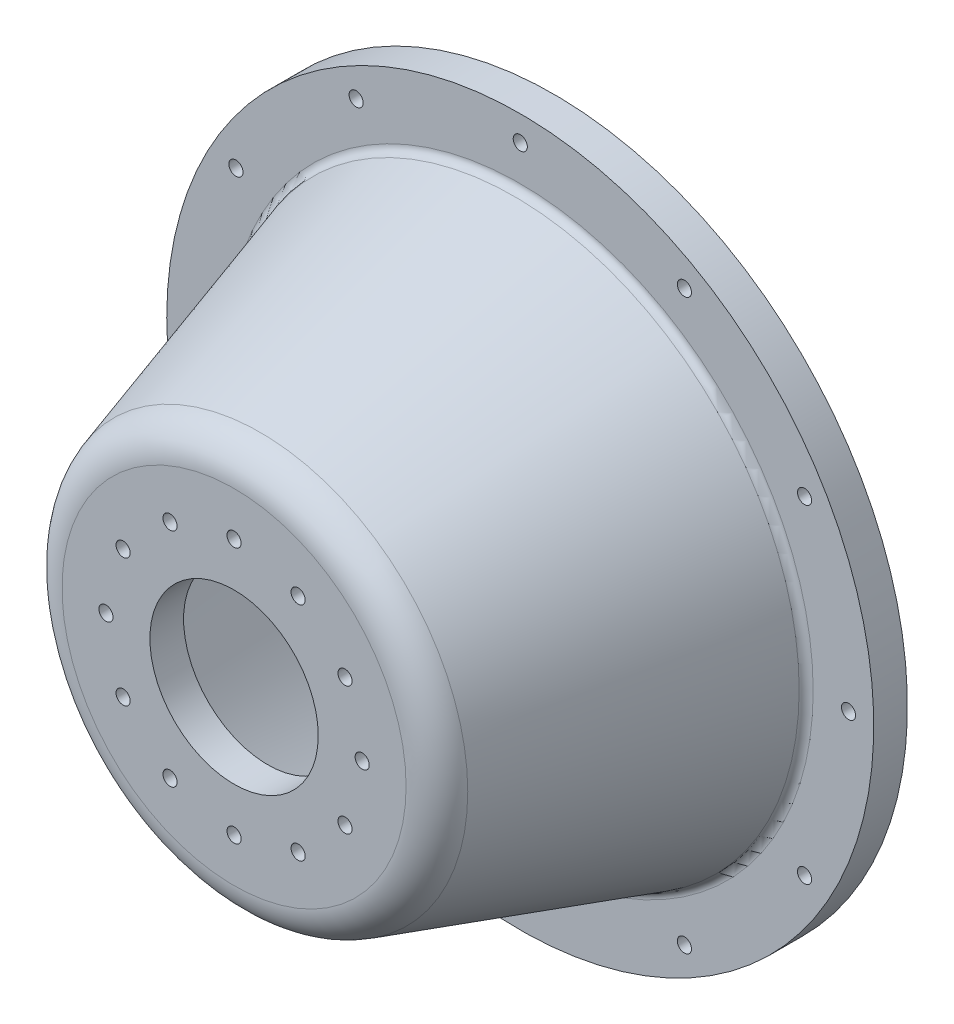
from build123d import *

# Parameters (mm, degrees)
SKETCH1_W                  = 210
SKETCH1_H                  = 20
SKETCH2_R                  = 170.296824317
BOSS_EXTRUDE1_DEPTH        = 170
BOSS_EXTRUDE1_TAPER        = 16.950103548
F_8_4_8_4_DIAMETER_HOLE1_D = 8.4
F_8_4_8_4_DIAMETER_HOLE2_D = 8.4
FILLET1_R                  = 2
FILLET2_R                  = 5
FILLET3_R                  = 22
FILLET4_R                  = 25


with BuildPart() as part:
    # Sketch1 → Revolve1 (revolve)
    with BuildSketch(Plane.XZ, mode=Mode.PRIVATE) as revolve1_sk:
        with Locations((105, 10)):
            Rectangle(SKETCH1_W, SKETCH1_H)
    revolve(revolve1_sk.sketch.rotate(Axis((0, 0, 20), (0, 0, -1)), 180), axis=Axis((0, 0, 20), (0, 0, -1)))

    # Sketch2 → Boss-Extrude1 (add)
    with BuildSketch(Plane.XY.offset(20)):
        Circle(SKETCH2_R)
    extrude(amount=BOSS_EXTRUDE1_DEPTH, taper=BOSS_EXTRUDE1_TAPER)

    # Sketch3 → Cut-Revolve1 (revolve, cut)
    with BuildSketch(Plane(origin=(0, 0, 0), x_dir=(1, 0, 0), z_dir=(0, 1, 0))):
        Polygon((155.484121585, 0), (0, 0), (0, -190), (50, -190), (50, -170), (103.671746464, -170), align=None)
    revolve(axis=Axis((0, 0, 0), (0, 0, 1)), mode=Mode.SUBTRACT)

    # Ø8.4 (8.4) Diameter Hole1 (through all)
    with Locations(Plane.XY.offset(20)):
        with Locations((0, 195), (97.5, 168.874953738), (168.874953738, 97.5), (195, 0), (168.874953738, -97.5), (97.5, -168.874953738), (0, -195), (-97.5, -168.874953738), (-168.874953738, -97.5), (-195, 0), (-168.874953738, 97.5), (-97.5, 168.874953738)):
            Hole(F_8_4_8_4_DIAMETER_HOLE1_D / 2)

    # Ø8.4 (8.4) Diameter Hole2 (through all)
    with Locations(Plane(origin=(0, 0, 170), x_dir=(-1, 0, 0), z_dir=(0, 0, -1))):
        with Locations((0, 76.095238095), (38.047619048, 65.900409298), (65.900409298, 38.047619048), (76.095238095, 0), (65.900409298, -38.047619048), (38.047619048, -65.900409298), (0, -76.095238095), (-38.047619048, -65.900409298), (-65.900409298, -38.047619048), (-76.095238095, 0), (-65.900409298, 38.047619048), (-38.047619048, 65.900409298)):
            Hole(F_8_4_8_4_DIAMETER_HOLE2_D / 2)

    # Fillet1
    fillet1_edges = [part.edges().sort_by_distance(p)[0] for p in [
        (-103.671746464, 0, 170),
    ]]
    fillet(fillet1_edges, radius=FILLET1_R)

    # Fillet2
    fillet2_edges = [part.edges().sort_by_distance(p)[0] for p in [
        (-170.296824317, 0, 20),
    ]]
    fillet(fillet2_edges, radius=FILLET2_R)

    # Fillet3
    fillet3_edges = [part.edges().sort_by_distance(p)[0] for p in [
        (-118.484449196, 0, 190),
    ]]
    fillet(fillet3_edges, radius=FILLET3_R)

    # Fillet4
    fillet4_edges = [part.edges().sort_by_distance(p)[0] for p in [
        (-155.484121585, 0, 0),
    ]]
    fillet(fillet4_edges, radius=FILLET4_R)


solid = part.part
